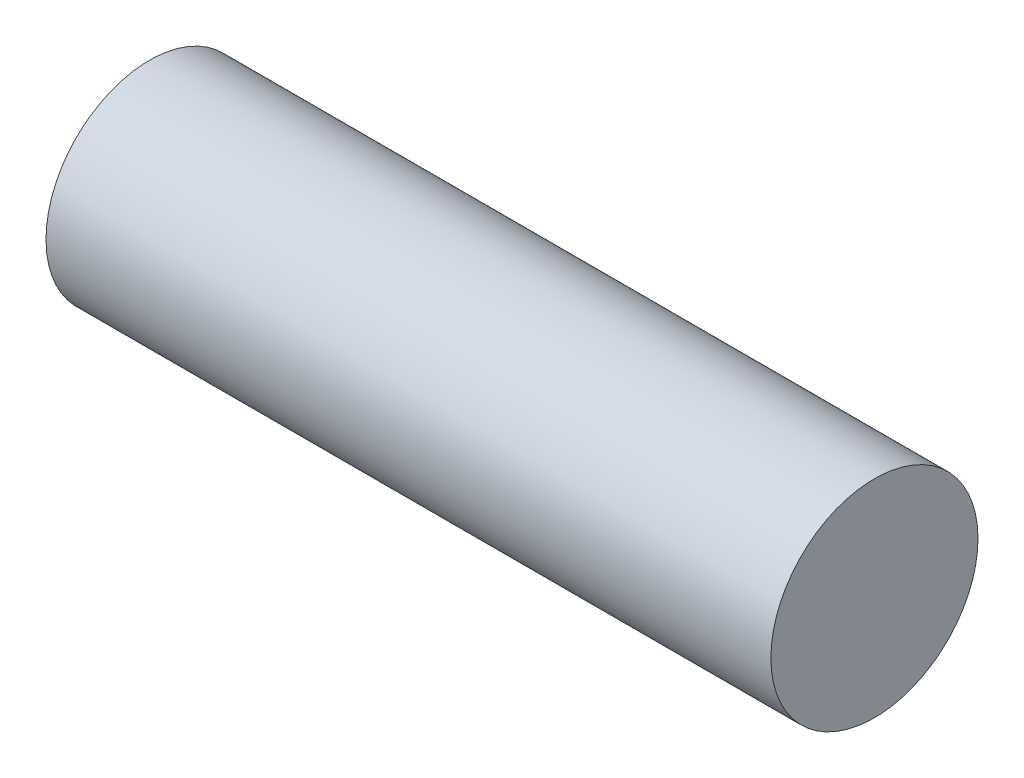
from build123d import *

# Parameters (mm, degrees)
ESQUISSE1_W = 14
ESQUISSE1_H = 4


with BuildPart() as part:
    # Esquisse1 → Révolution1 (revolve)
    with BuildSketch(Plane.XY, mode=Mode.PRIVATE) as r_volution1_sk:
        with Locations((-7, 2)):
            Rectangle(ESQUISSE1_W, ESQUISSE1_H)
        with Locations((7, 2)):
            Rectangle(ESQUISSE1_W, ESQUISSE1_H)
    revolve(r_volution1_sk.sketch.rotate(Axis((14, 0, 0), (-1, 0, 0)), 90), axis=Axis((14, 0, 0), (-1, 0, 0)))


solid = part.part
